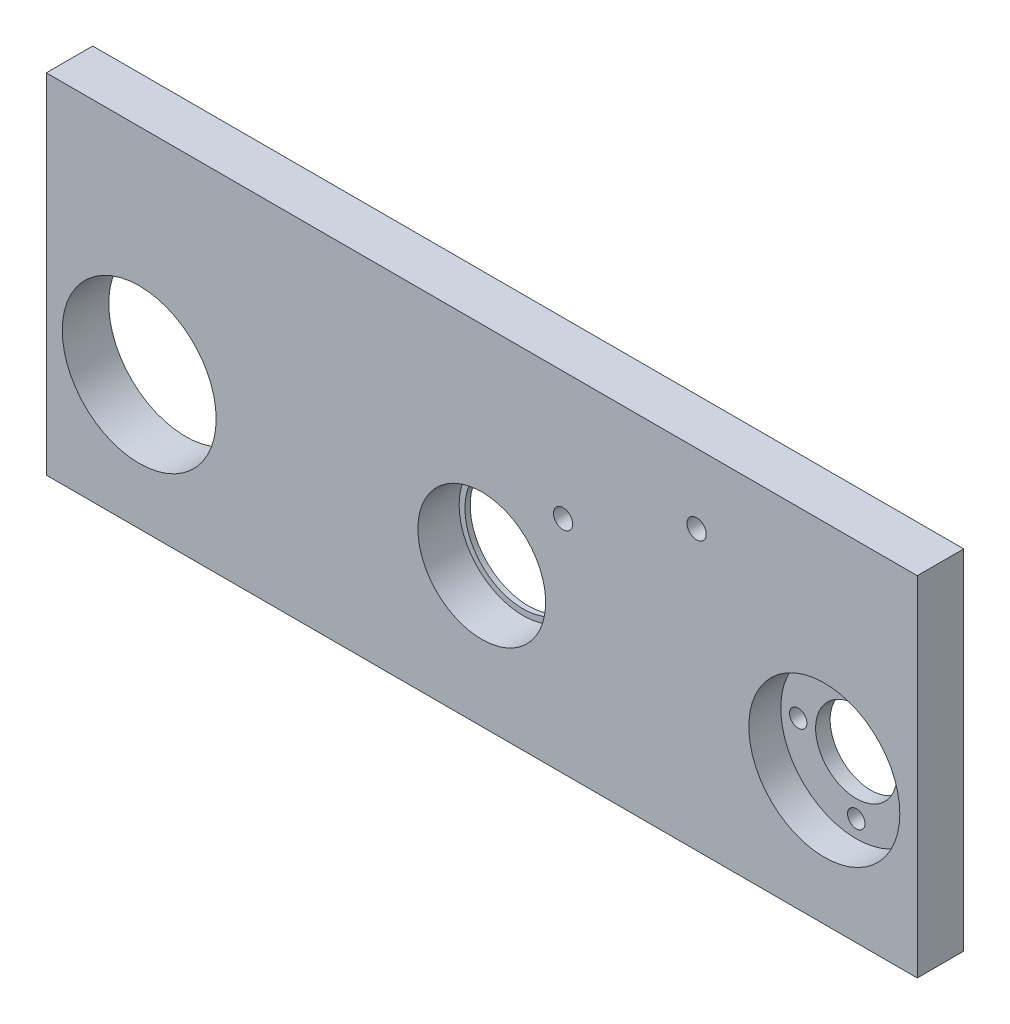
from build123d import *

# Parameters (mm, degrees)
ESQUISSE1_W                  = 150
ESQUISSE1_H                  = 60
BOSS_EXTRU_1_DEPTH           = 8
ENL_V_MAT_EXTRU_1_DEPTH      = 162.752897965
ENL_V_MAT_EXTRU_1_DEPTH_BACK = 7.1
ESQUISSE2_R                  = 11
ESQUISSE3_R                  = 10
ENL_V_MAT_EXTRU_2_DEPTH      = 162.710883987
ESQUISSE4_R                  = 7
ENL_V_MAT_EXTRU_3_DEPTH      = 162.752897965
ESQUISSE5_R                  = 13
ENL_V_MAT_EXTRU_4_DEPTH      = 5.5
ENL_V_MAT_EXTRU_5_DEPTH      = 162.752897965
ENL_V_MAT_EXTRU_5_DEPTH_BACK = 162.752897965
ESQUISSE6_R                  = 13.25
ENL_V_MAT_EXTRU_6_DEPTH      = 162.752897965
ENL_V_MAT_EXTRU_6_DEPTH_BACK = 162.752897965
ESQUISSE7_R                  = 1.65
ENL_V_MAT_EXTRU_7_DEPTH      = 162.648538503
ENL_V_MAT_EXTRU_7_DEPTH_BACK = 162.648538503
ESQUISSE8_R                  = 1.5


with BuildPart() as part:
    # Esquisse1 → Boss.-Extru.1 (new body)
    with BuildSketch(Plane.XY):
        with Locations((75, 30)):
            Rectangle(ESQUISSE1_W, ESQUISSE1_H)
    extrude(amount=BOSS_EXTRU_1_DEPTH)

    # Esquisse2 → Enlèv. mat.-Extru.1 (cut, two sides: drawn at the far end of the back side and taken through both)
    with BuildSketch(Plane.XY.offset(8).offset(-ENL_V_MAT_EXTRU_1_DEPTH_BACK)):
        with Locations(Location((75, 24, 0), (0, 0, 180))):
            Circle(ESQUISSE2_R)
    extrude(amount=ENL_V_MAT_EXTRU_1_DEPTH + ENL_V_MAT_EXTRU_1_DEPTH_BACK, mode=Mode.SUBTRACT)

    # Esquisse3 → Enlèv. mat.-Extru.2 (cut, through all)
    with BuildSketch(Plane.XY.offset(0.9)):
        with Locations((75, 24)):
            Circle(ESQUISSE3_R)
    extrude(amount=-ENL_V_MAT_EXTRU_2_DEPTH, mode=Mode.SUBTRACT)

    # Esquisse4 → Enlèv. mat.-Extru.3 (cut, through all)
    with BuildSketch(Plane.XY.offset(8)):
        with Locations((133.991524815, 23)):
            Circle(ESQUISSE4_R)
    extrude(amount=-ENL_V_MAT_EXTRU_3_DEPTH, mode=Mode.SUBTRACT)

    # Esquisse5 → Enlèv. mat.-Extru.4 (cut)
    with BuildSketch(Plane.XY.offset(8)):
        with Locations((133.991524815, 23)):
            Circle(ESQUISSE5_R)
    extrude(amount=-ENL_V_MAT_EXTRU_4_DEPTH, mode=Mode.SUBTRACT)

    # Esquisse6 → Enlèv. mat.-Extru.5 (cut, two sides: drawn at the far end of the back side and taken through both)
    with BuildSketch(Plane.XY.offset(8).offset(-ENL_V_MAT_EXTRU_5_DEPTH_BACK)):
        with Locations((16.008475185, 23)):
            Circle(ESQUISSE6_R)
    extrude(amount=ENL_V_MAT_EXTRU_5_DEPTH + ENL_V_MAT_EXTRU_5_DEPTH_BACK, mode=Mode.SUBTRACT)

    # Esquisse7 → Enlèv. mat.-Extru.6 (cut, two sides: drawn at the far end of the back side and taken through both)
    with BuildSketch(Plane.XY.offset(8).offset(-ENL_V_MAT_EXTRU_6_DEPTH_BACK)):
        with Locations((89, 38)):
            Circle(ESQUISSE7_R)
        with Locations((112, 48)):
            Circle(ESQUISSE7_R)
    extrude(amount=ENL_V_MAT_EXTRU_6_DEPTH + ENL_V_MAT_EXTRU_6_DEPTH_BACK, mode=Mode.SUBTRACT)

    # Esquisse8 → Enlèv. mat.-Extru.7 (cut, two sides: drawn at the far end of the back side and taken through both)
    with BuildSketch(Plane.XY.offset(2.5).offset(-ENL_V_MAT_EXTRU_7_DEPTH_BACK)):
        with Locations((133.991524815, 13)):
            Circle(ESQUISSE8_R)
        with Locations((123.991524815, 23)):
            Circle(ESQUISSE8_R)
        with Locations((133.991524815, 33)):
            Circle(ESQUISSE8_R)
        with Locations((143.991524815, 23)):
            Circle(ESQUISSE8_R)
    extrude(amount=ENL_V_MAT_EXTRU_7_DEPTH + ENL_V_MAT_EXTRU_7_DEPTH_BACK, mode=Mode.SUBTRACT)


solid = part.part
